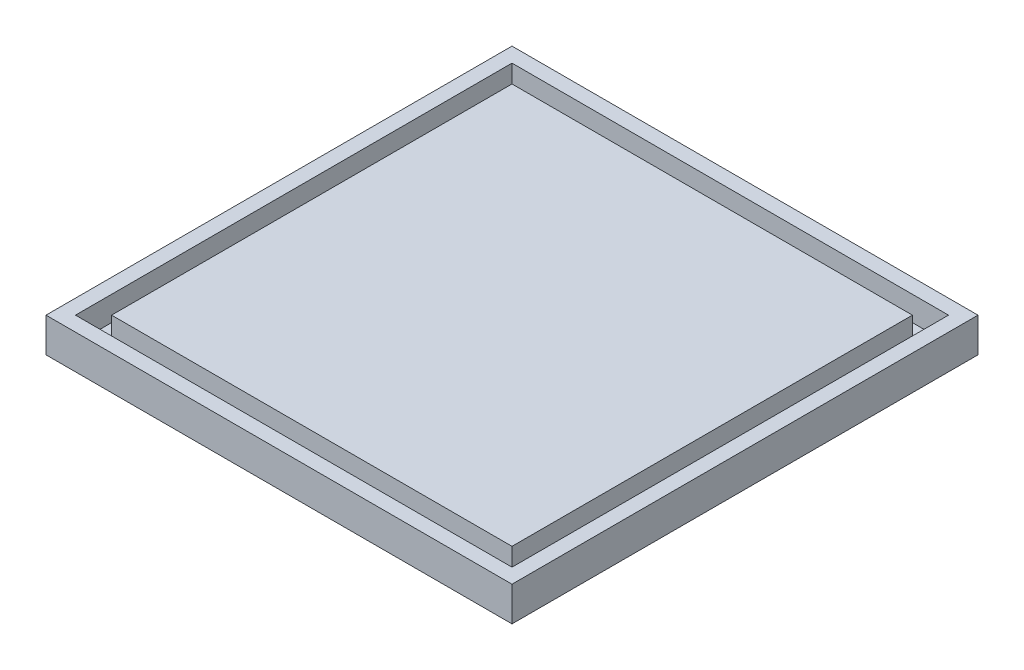
from build123d import *

# Parameters (mm, degrees)
SKETCH1_W             = 94.85
SKETCH1_H             = 94.85
SKETCH1_W_2           = 88.85
SKETCH1_H_2           = 88.85
BOSS_EXTRUDE1_DEPTH   = 5
SKETCH1_W_3           = 81.5
SKETCH1_H_3           = 81.5
BOSS_EXTRUDE1_2_DEPTH = 5
SKETCH2_W             = 94.85
SKETCH2_H             = 94.85
BOSS_EXTRUDE2_DEPTH   = 2


with BuildPart() as part:
    # Sketch1 → Boss-Extrude1 (new body)
    with BuildSketch(Plane(origin=(0, 0, 0), x_dir=(1, 0, 0), z_dir=(0, 1, 0))):
        with Locations((40.75, 40.75)):
            Rectangle(SKETCH1_W, SKETCH1_H)
        with Locations((40.75, 40.75)):
            Rectangle(SKETCH1_W_2, SKETCH1_H_2, mode=Mode.SUBTRACT)
    extrude(amount=BOSS_EXTRUDE1_DEPTH)



with BuildPart() as body_2:
    # Sketch1 → Boss-Extrude1 2 (new body)
    with BuildSketch(Plane(origin=(0, 0, 0), x_dir=(1, 0, 0), z_dir=(0, 1, 0))):
        with Locations((40.75, 40.75)):
            Rectangle(SKETCH1_W_3, SKETCH1_H_3)
    extrude(amount=BOSS_EXTRUDE1_2_DEPTH)


with BuildPart() as part_1:
    add(part.part)

    add(body_2.part)  # Boss-Extrude2 merges body 2
    # Sketch2 → Boss-Extrude2 (add)
    with BuildSketch(Plane.XZ):
        with Locations((40.75, -40.75)):
            Rectangle(SKETCH2_W, SKETCH2_H)
    extrude(amount=BOSS_EXTRUDE2_DEPTH)


solid = part_1.part
